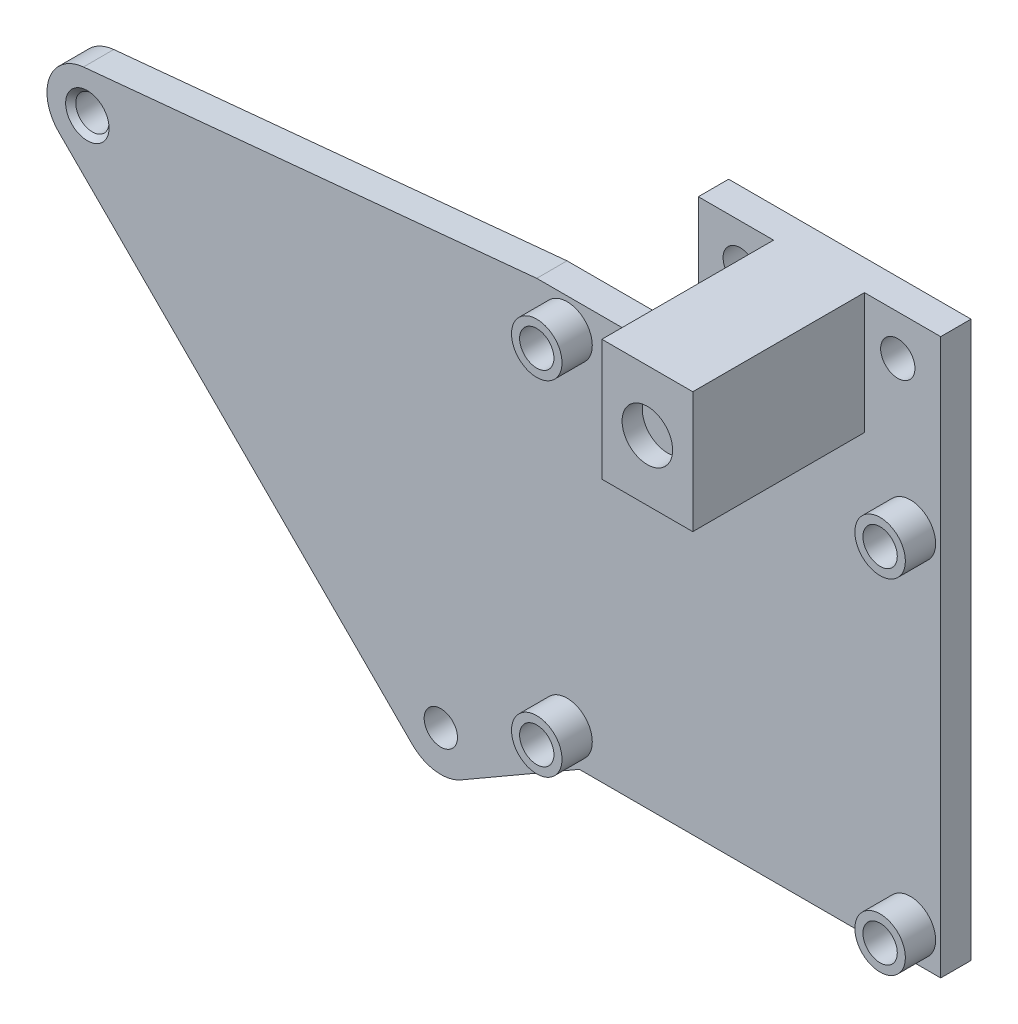
from build123d import *

# Parameters (mm, degrees)
SKETCH1_R           = 1.7
SKETCH1_R_2         = 1.65
BOSS_EXTRUDE1_DEPTH = 3
CHAMFER2_SIZE       = 0.5
SKETCH2_W           = 9
SKETCH2_H           = 12
BOSS_EXTRUDE2_DEPTH = 17
SKETCH3_R           = 2.5
CUT_EXTRUDE1_DEPTH  = 2
SKETCH4_R           = 2.5
SKETCH4_R_2         = 1.7
BOSS_EXTRUDE3_DEPTH = 3


with BuildPart() as part:
    # Sketch1 → Boss-Extrude1 (new body)
    with BuildSketch(Plane.XY):
        with BuildLine():
            Line((20, 20), (20, -20))
            Line((20, -20), (-15.784232335, -20))
            Line((-15.784232335, -20), (-27.5, -26.764101615))
            ThreePointArc((-27.5, -26.764101615), (-30.022104769, -27.265779445), (-32.328427125, -26.128427125))
            Line((-32.328427125, -26.128427125), (-67.328427125, 8.871572875))
            ThreePointArc((-67.328427125, 8.871572875), (-68.264653884, 13.051806618), (-64.883087414, 15.681613245))
            Line((-64.883087414, 15.681613245), (-20, 20))
            Line((-20, 20), (-4, 20))
            Line((-4, 20), (-4, 35))
            Line((-4, 35), (20, 35))
            Line((20, 35), (20, 20))
        make_face()
        with Locations((-17, 17)):
            Circle(SKETCH1_R, mode=Mode.SUBTRACT)
        with Locations((17, 17)):
            Circle(SKETCH1_R, mode=Mode.SUBTRACT)
        with Locations((17, -17)):
            Circle(SKETCH1_R, mode=Mode.SUBTRACT)
        with Locations((-17, -17)):
            Circle(SKETCH1_R, mode=Mode.SUBTRACT)
        with Locations((0.15, 31)):
            Circle(SKETCH1_R, mode=Mode.SUBTRACT)
        with Locations((15.75, 31)):
            Circle(SKETCH1_R, mode=Mode.SUBTRACT)
        with Locations((-64.5, 11.7)):
            Circle(SKETCH1_R_2, mode=Mode.SUBTRACT)
        with Locations((-29.5, -23.3)):
            Circle(SKETCH1_R_2, mode=Mode.SUBTRACT)
    extrude(amount=BOSS_EXTRUDE1_DEPTH)

    # Chamfer2
    chamfer2_edges = [part.edges().sort_by_distance(p)[0] for p in [
        (-66.15, 11.7, 3),
    ]]
    chamfer(chamfer2_edges, length=CHAMFER2_SIZE)

    # Sketch2 → Boss-Extrude2 (add)
    with BuildSketch(Plane.XY.offset(3)):
        with Locations((7.95, 29)):
            Rectangle(SKETCH2_W, SKETCH2_H)
    extrude(amount=BOSS_EXTRUDE2_DEPTH)

    # Sketch3 → Cut-Extrude1 (cut)
    with BuildSketch(Plane.XY.offset(20)):
        with Locations((7.95, 29)):
            Circle(SKETCH3_R)
    extrude(amount=-CUT_EXTRUDE1_DEPTH, mode=Mode.SUBTRACT)

    # Sketch4 → Boss-Extrude3 (add)
    # profile 1 of 4: a face of its own
    with BuildSketch(Plane.XY.offset(3)):
        with Locations((-17, 17)):
            Circle(SKETCH4_R)
        with Locations((-17, 17)):
            Circle(SKETCH4_R_2, mode=Mode.SUBTRACT)
    # profile 2 of 4: a face of its own
    with BuildSketch(Plane.XY.offset(3)):
        with Locations((17, 17)):
            Circle(SKETCH4_R)
        with Locations((17, 17)):
            Circle(SKETCH4_R_2, mode=Mode.SUBTRACT)
    # profile 3 of 4: a face of its own
    with BuildSketch(Plane.XY.offset(3)):
        with Locations((-17, -17)):
            Circle(SKETCH4_R)
        with Locations((-17, -17)):
            Circle(SKETCH4_R_2, mode=Mode.SUBTRACT)
    # profile 4 of 4: a face of its own
    with BuildSketch(Plane.XY.offset(3)):
        with Locations((17, -17)):
            Circle(SKETCH4_R)
        with Locations((17, -17)):
            Circle(SKETCH4_R_2, mode=Mode.SUBTRACT)
    extrude(amount=BOSS_EXTRUDE3_DEPTH)


solid = part.part
